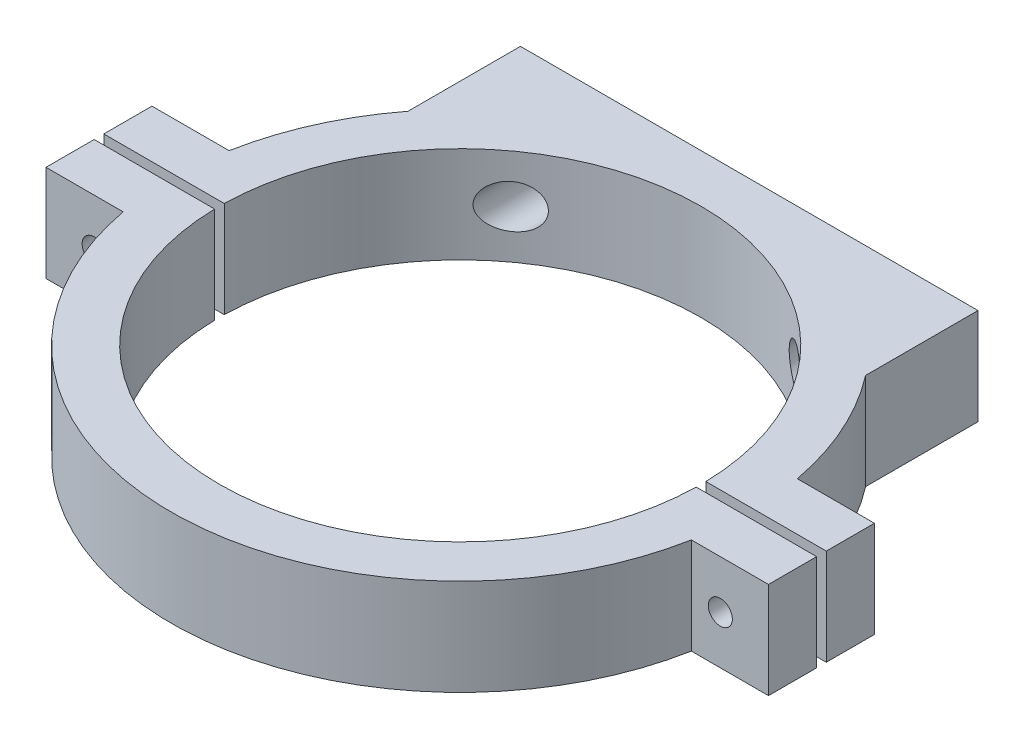
from build123d import *

# Parameters (mm, degrees)
BOSS_EXTRUDE1_DEPTH   = 20
BOSS_EXTRUDE1_2_DEPTH = 20
SKETCH2_R             = 2.5
CUT_EXTRUDE1_DEPTH    = 50
SKETCH4_R             = 4.5
CUT_EXTRUDE2_DEPTH    = 50
SKETCH5_R             = 2
CUT_EXTRUDE3_DEPTH    = 10
SKETCH6_R             = 2.5
CUT_EXTRUDE4_DEPTH    = 10


with BuildPart() as part:
    # Sketch1 → Boss-Extrude1 (new body)
    with BuildSketch(Plane(origin=(0, 0, 0), x_dir=(1, 0, 0), z_dir=(0, 1, 0))):
        with BuildLine():
            Line((-47.5, 60), (47.5, 60))
            Line((47.5, 60), (47.5, 36.657195747))
            ThreePointArc((47.5, 36.657195747), (54.765251969, 24.510552356), (58.983048412, 11))
            Line((58.983048412, 11), (75, 11))
            Line((75, 11), (75, 1))
            Line((75, 1), (49.989999, 1))
            ThreePointArc((49.989999, 1), (0, 50), (-49.989999, 1))
            Line((-49.989999, 1), (-75, 1))
            Line((-75, 1), (-75, 11))
            Line((-75, 11), (-58.983048412, 11))
            ThreePointArc((-58.983048412, 11), (-54.765251969, 24.510552356), (-47.5, 36.657195747))
            Line((-47.5, 36.657195747), (-47.5, 60))
        make_face()
    extrude(amount=BOSS_EXTRUDE1_DEPTH)

    # Sketch2 → Cut-Extrude1 (cut)
    with BuildSketch(Plane(origin=(0, 0, -60), x_dir=(-1, 0, 0), z_dir=(0, 0, -1))):
        with Locations((-29.5, 10)):
            Circle(SKETCH2_R)
        with Locations((29.5, 10)):
            Circle(SKETCH2_R)
    extrude(amount=-CUT_EXTRUDE1_DEPTH, mode=Mode.SUBTRACT)

    # Sketch4 → Cut-Extrude2 (cut)
    with BuildSketch(Plane(origin=(0, 0, -50), x_dir=(-1, 0, 0), z_dir=(0, 0, -1))):
        with Locations((-29.5, 10)):
            Circle(SKETCH4_R)
        with Locations((29.5, 10)):
            Circle(SKETCH4_R)
    extrude(amount=-CUT_EXTRUDE2_DEPTH, mode=Mode.SUBTRACT)

    # Sketch5 → Cut-Extrude3 (cut)
    with BuildSketch(Plane(origin=(0, 0, -11), x_dir=(-1, 0, 0), z_dir=(0, 0, -1))):
        with Locations((-65, 10)):
            Circle(SKETCH5_R)
        with Locations((65, 10)):
            Circle(SKETCH5_R)
    extrude(amount=-CUT_EXTRUDE3_DEPTH, mode=Mode.SUBTRACT)


with BuildPart() as body_2:
    # Sketch1 → Boss-Extrude1 2 (new body)
    with BuildSketch(Plane(origin=(0, 0, 0), x_dir=(1, 0, 0), z_dir=(0, 1, 0))):
        with BuildLine():
            Line((-75, -11), (-58.983048412, -11))
            ThreePointArc((-58.983048412, -11), (0, -60), (58.983048412, -11))
            Line((58.983048412, -11), (75, -11))
            Line((75, -11), (75, -1))
            Line((75, -1), (49.989999, -1))
            ThreePointArc((49.989999, -1), (0, -50), (-49.989999, -1))
            Line((-49.989999, -1), (-75, -1))
            Line((-75, -1), (-75, -11))
        make_face()
    extrude(amount=BOSS_EXTRUDE1_2_DEPTH)

    # Sketch6 → Cut-Extrude4 (cut)
    with BuildSketch(Plane.XY.offset(11)):
        with Locations((65, 10)):
            Circle(SKETCH6_R)
        with Locations((-65, 10)):
            Circle(SKETCH6_R)
    extrude(amount=-CUT_EXTRUDE4_DEPTH, mode=Mode.SUBTRACT)


solid = Compound([part.part, body_2.part])
